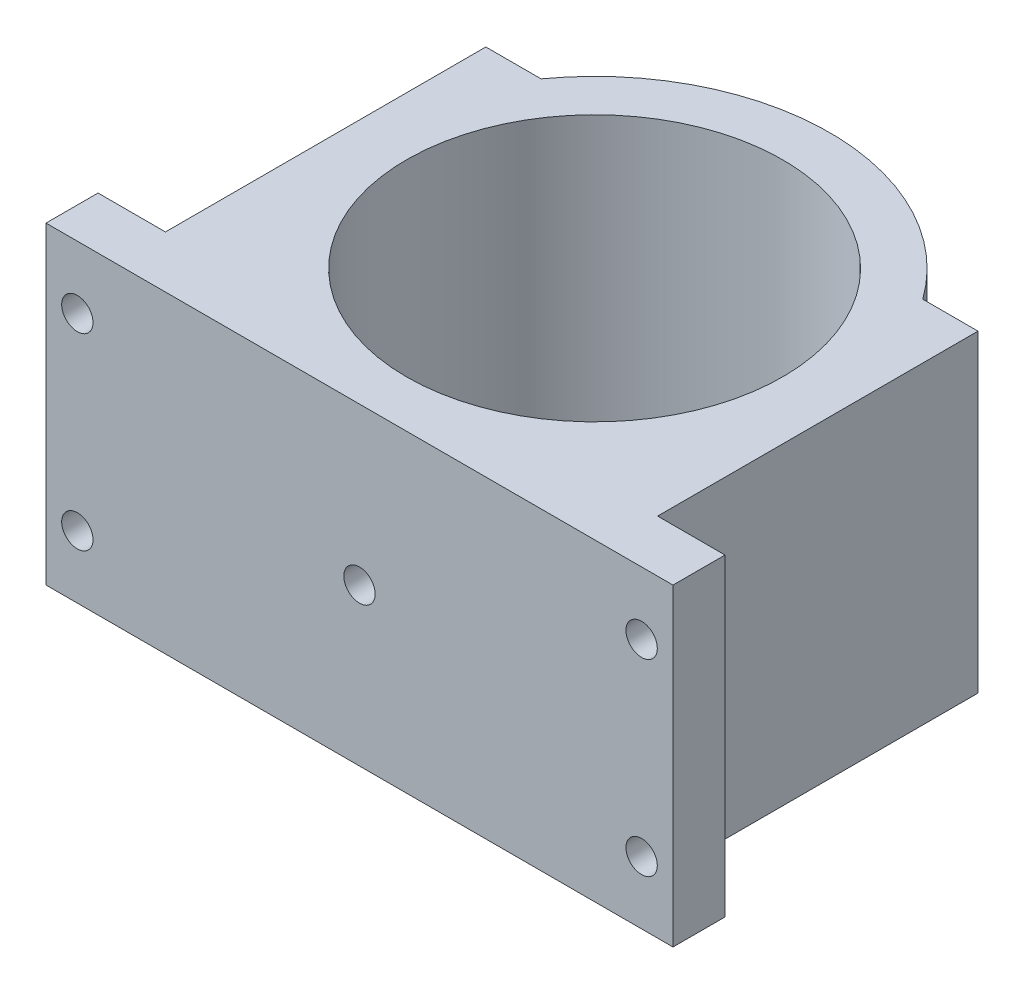
from build123d import *

# Parameters (mm, degrees)
SKETCH1_R                  = 60
BOSS_EXTRUDE1_DEPTH        = 100
M8_CLEARANCE_HOLE1_D       = 10
F_10_0MM_DOWEL_HOLE1_D     = 10
F_10_0MM_DOWEL_HOLE1_DEPTH = 8
F_10_0MM_DOWEL_HOLE1_TIP   = 3.004303095


with BuildPart() as part:
    # Sketch1 → Boss-Extrude1 (new body)
    with BuildSketch(Plane(origin=(0, 0, 0), x_dir=(1, 0, 0), z_dir=(0, 1, 0))):
        with BuildLine():
            Line((-100, -75), (100, -75))
            Line((100, -75), (100, -58.4))
            Line((100, -58.4), (78.5, -58.4))
            Line((78.5, -58.4), (78.5, 0))
            Line((78.5, 0), (78.5, 43.8))
            Line((78.5, 43.8), (60.881524291, 43.8))
            ThreePointArc((60.881524291, 43.8), (0, 75), (-60.881524291, 43.8))
            Line((-60.881524291, 43.8), (-78.5, 43.8))
            Line((-78.5, 43.8), (-78.5, 0))
            Line((-78.5, 0), (-78.5, -58.4))
            Line((-78.5, -58.4), (-100, -58.4))
            Line((-100, -58.4), (-100, -75))
        make_face()
        with Locations(Location((0, 0, 0), (0, 0, 270))):
            Circle(SKETCH1_R, mode=Mode.SUBTRACT)
    extrude(amount=BOSS_EXTRUDE1_DEPTH)

    # M8 Clearance Hole1 (through all)
    with Locations(Plane.XY.offset(75)):
        with Locations((-90, 80), (-90, 20), (90, 20), (90, 80)):
            Hole(M8_CLEARANCE_HOLE1_D / 2)

    # Ø10.0mm Dowel Hole1
    with Locations(Plane.XY.offset(75)):
        with Locations((0, 50)):
            Hole(F_10_0MM_DOWEL_HOLE1_D / 2, depth=F_10_0MM_DOWEL_HOLE1_DEPTH)
            with Locations((0, 0, -(F_10_0MM_DOWEL_HOLE1_DEPTH + F_10_0MM_DOWEL_HOLE1_TIP / 2))):  # 118° drill point
                Cone(0, F_10_0MM_DOWEL_HOLE1_D / 2, F_10_0MM_DOWEL_HOLE1_TIP, mode=Mode.SUBTRACT)


solid = part.part
